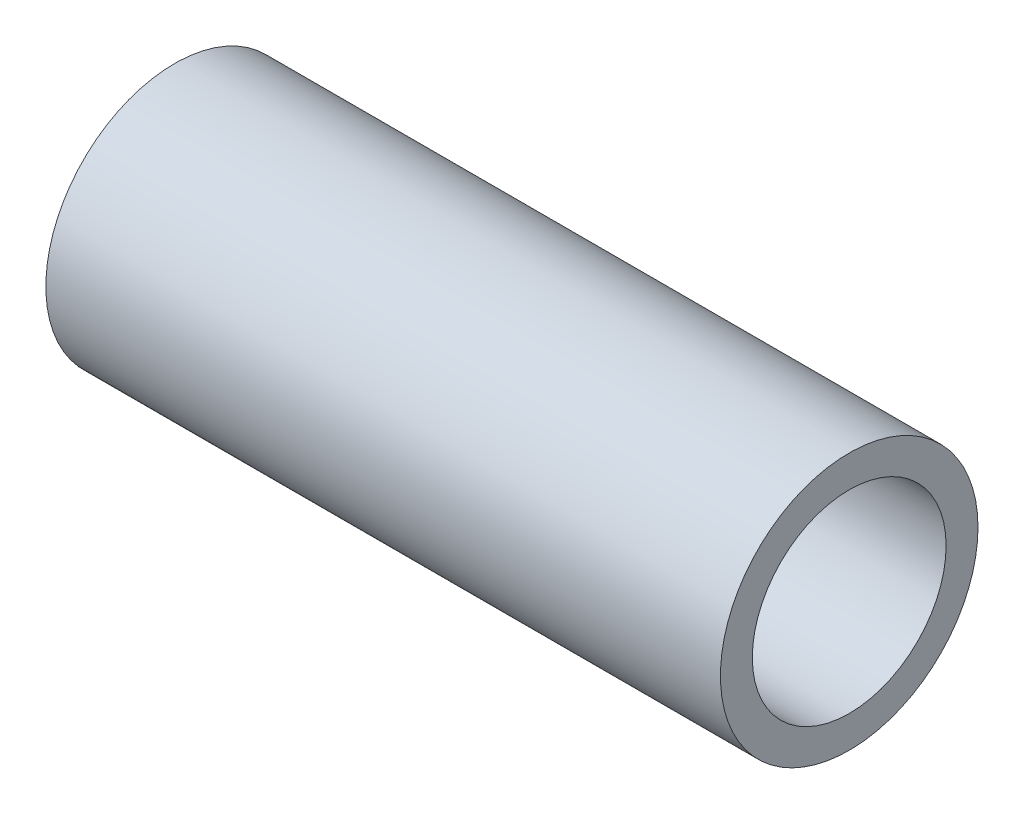
from build123d import *

# Parameters (mm, degrees)
SKETCH1_R           = 10.5
SKETCH1_R_2         = 7.9
BOSS_EXTRUDE1_DEPTH = 55


with BuildPart() as part:
    # Sketch1 → Boss-Extrude1 (new body)
    with BuildSketch(Plane(origin=(0, 0, 0), x_dir=(0, 0, -1), z_dir=(1, 0, 0))):
        Circle(SKETCH1_R)
        Circle(SKETCH1_R_2, mode=Mode.SUBTRACT)
    extrude(amount=BOSS_EXTRUDE1_DEPTH)


solid = part.part
